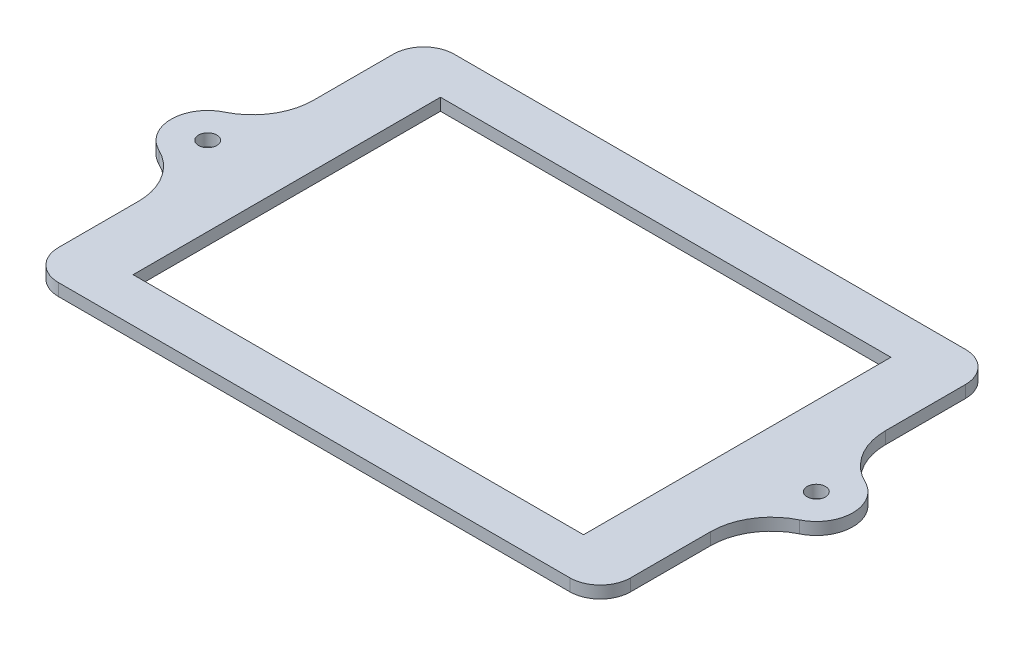
from build123d import *

# Parameters (mm, degrees)
SKETCH2_R           = 1.5
SKETCH2_W           = 74
SKETCH2_H           = 50.5
BOSS_EXTRUDE1_DEPTH = 2
FILLET1_R           = 5
FILLET2_R           = 10


with BuildPart() as part:
    # Sketch2 → Boss-Extrude1 (new body)
    with BuildSketch(Plane(origin=(0, 0, 0), x_dir=(1, 0, 0), z_dir=(0, 1, 0))):
        with BuildLine():
            Line((-47, 32.5), (47, 32.5))
            Line((47, 32.5), (47, 5.196152423))
            ThreePointArc((47, 5.196152423), (56, 0), (47, -5.196152423))
            Line((47, -5.196152423), (47, -32.5))
            Line((47, -32.5), (-47, -32.5))
            Line((-47, -32.5), (-47, -5.196152423))
            ThreePointArc((-47, -5.196152423), (-56, 0), (-47, 5.196152423))
            Line((-47, 5.196152423), (-47, 32.5))
        make_face()
        with Locations(Location((-50, 0, 0), (0, 0, 270))):
            Circle(SKETCH2_R, mode=Mode.SUBTRACT)
        with Locations(Location((50, 0, 0), (0, 0, 270))):
            Circle(SKETCH2_R, mode=Mode.SUBTRACT)
        Rectangle(SKETCH2_W, SKETCH2_H, mode=Mode.SUBTRACT)
    extrude(amount=BOSS_EXTRUDE1_DEPTH)

    # Fillet1
    fillet1_edges = [part.edges().sort_by_distance(p)[0] for p in [
        (-47, 1, -32.5),
        (47, 1, -32.5),
        (47, 1, 32.5),
        (-47, 1, 32.5),
    ]]
    fillet(fillet1_edges, radius=FILLET1_R)

    # Fillet2
    fillet2_edges = [part.edges().sort_by_distance(p)[0] for p in [
        (47, 1, -5.196152423),
        (47, 1, 5.196152423),
        (-47, 1, 5.196152423),
        (-47, 1, -5.196152423),
    ]]
    fillet(fillet2_edges, radius=FILLET2_R)


solid = part.part
